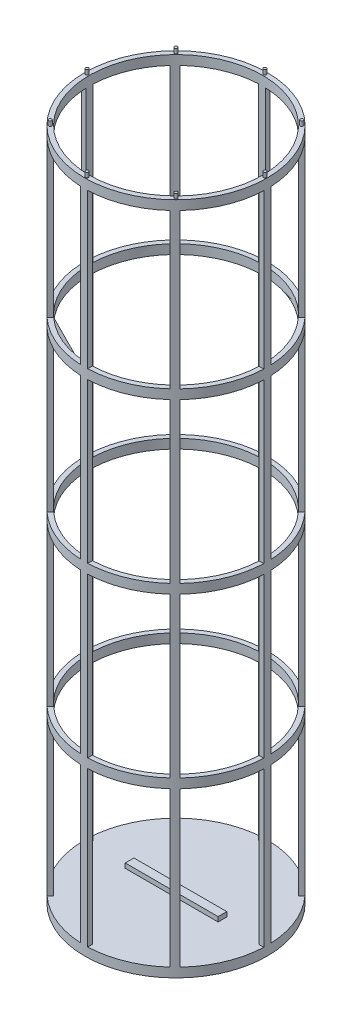
from build123d import *

# Parameters (mm, degrees)
SKETCH1_R           = 49.53
SKETCH1_R_2         = 46.99
BOSS_EXTRUDE1_DEPTH = 182.88
CUT_EXTRUDE1_DEPTH  = 177.8
SKETCH3_R           = 49.53
SKETCH3_R_2         = 46.99
BOSS_EXTRUDE2_DEPTH = 2.54
SKETCH4_R           = 49.53
SKETCH4_R_2         = 46.99
BOSS_EXTRUDE3_DEPTH = 2.54
BOSS_EXTRUDE4_START = -5.08
SKETCH5_R           = 49.53
BOSS_EXTRUDE4_DEPTH = 5.08
SKETCH6_W           = 50.419
SKETCH6_H           = 4.699
BOSS_EXTRUDE5_DEPTH = 2.54
SKETCH7_R           = 0.8255
BOSS_EXTRUDE6_DEPTH = 2.54
CIRPATTERN2_COUNT   = 8


with BuildPart() as part:
    # Sketch1 → Boss-Extrude1 (new, symmetric)
    with BuildSketch(Plane(origin=(0, 0, 0), x_dir=(1, 0, 0), z_dir=(0, 1, 0))):
        with Locations(Location((0, 0, 0), (0, 0, 270))):
            Circle(SKETCH1_R)
        with Locations(Location((0, 0, 0), (0, 0, 270))):
            Circle(SKETCH1_R_2, mode=Mode.SUBTRACT)
    extrude(amount=BOSS_EXTRUDE1_DEPTH, both=True)

    # Sketch2 → Cut-Extrude1 (cut, symmetric)
    with BuildSketch(Plane(origin=(0, 0, 0), x_dir=(1, 0, 0), z_dir=(0, 1, 0))):
        with BuildLine():
            Line((34.339077963, -32.07628134), (36.13611782, -33.873321197))
            ThreePointArc((36.13611782, -33.873321197), (45.710930003, -19.071753413), (49.49527883, -1.854258207))
            Line((49.49527883, -1.854258207), (46.953400585, -1.854258207))
            ThreePointArc((46.953400585, -1.854258207), (43.364264524, -18.099742051), (34.339077963, -32.07628134))
        make_face()
        with BuildLine():
            ThreePointArc((1.584890151, -49.504636381), (18.664975227, -45.878530924), (33.425440685, -36.550797734))
            Line((33.425440685, -36.550797734), (31.627502039, -34.752859088))
            ThreePointArc((31.627502039, -34.752859088), (17.692915235, -43.531837205), (1.584890151, -46.963264614))
            Line((1.584890151, -46.963264614), (1.584890151, -49.504636381))
        make_face()
        with BuildLine():
            ThreePointArc((-33.543952964, -36.442065248), (-19.03558139, -45.726005086), (-2.225109849, -49.479993797))
            Line((-2.225109849, -49.479993797), (-2.225109849, -46.937287801))
            ThreePointArc((-2.225109849, -46.937287801), (-18.063572268, -43.379343666), (-31.746279167, -34.644391451))
            Line((-31.746279167, -34.644391451), (-33.543952964, -36.442065248))
        make_face()
        with BuildLine():
            Line((46.949282998, 1.955741793), (49.491372723, 1.955741793))
            ThreePointArc((49.491372723, 1.955741793), (45.777644234, 18.911059948), (36.442065248, 33.543952964))
            Line((36.442065248, 33.543952964), (34.644391451, 31.746279167))
            ThreePointArc((34.644391451, 31.746279167), (43.430990742, 17.93903964), (46.949282998, 1.955741793))
        make_face()
        with BuildLine():
            ThreePointArc((-49.49527883, -1.854258207), (-45.741824116, -18.997537381), (-36.245883162, -33.755841773))
            Line((-36.245883162, -33.755841773), (-34.448634556, -31.958593167))
            ThreePointArc((-34.448634556, -31.958593167), (-43.39516767, -18.025524205), (-46.953400585, -1.854258207))
            Line((-46.953400585, -1.854258207), (-49.49527883, -1.854258207))
        make_face()
        with BuildLine():
            Line((31.958593167, 34.448634556), (33.755841773, 36.245883162))
            ThreePointArc((33.755841773, 36.245883162), (18.873008967, 45.79334485), (1.584890151, 49.504636381))
            Line((1.584890151, 49.504636381), (1.584890151, 46.963264614))
            ThreePointArc((1.584890151, 46.963264614), (17.900986276, 43.446689061), (31.958593167, 34.448634556))
        make_face()
        with BuildLine():
            ThreePointArc((-36.550797734, 33.425440685), (-45.80828813, 18.836709868), (-49.491372723, 1.955741793))
            Line((-49.491372723, 1.955741793), (-46.949282998, 1.955741793))
            ThreePointArc((-46.949282998, 1.955741793), (-43.461630715, 17.864678995), (-34.752859088, 31.627502039))
            Line((-34.752859088, 31.627502039), (-36.550797734, 33.425440685))
        make_face()
        with BuildLine():
            Line((-2.225109849, 46.937287801), (-2.225109849, 49.479993797))
            ThreePointArc((-2.225109849, 49.479993797), (-19.242893169, 45.63914945), (-33.873321197, 36.13611782))
            Line((-33.873321197, 36.13611782), (-32.07628134, 34.339077963))
            ThreePointArc((-32.07628134, 34.339077963), (-18.270880717, 43.292436035), (-2.225109849, 46.937287801))
        make_face()
    extrude(amount=CUT_EXTRUDE1_DEPTH, both=True, mode=Mode.SUBTRACT)

    # Sketch3 → Boss-Extrude2 (add, symmetric)
    with BuildSketch(Plane(origin=(0, 91.44, 0), x_dir=(1, 0, 0), z_dir=(0, 1, 0))):
        with Locations(Location((0, 0, 0), (0, 0, 270))):
            Circle(SKETCH3_R)
        with Locations(Location((0, 0, 0), (0, 0, 270))):
            Circle(SKETCH3_R_2, mode=Mode.SUBTRACT)
    boss_extrude2 = extrude(amount=BOSS_EXTRUDE2_DEPTH, both=True)

    # Mirror1: Boss-Extrude2 across plane
    add(boss_extrude2.mirror(Plane.ZX))

    # Sketch4 → Boss-Extrude3 (add, symmetric)
    with BuildSketch(Plane(origin=(0, 0, 0), x_dir=(1, 0, 0), z_dir=(0, 1, 0))):
        with Locations(Location((0, 0, 0), (0, 0, 270))):
            Circle(SKETCH4_R)
        with Locations(Location((0, 0, 0), (0, 0, 270))):
            Circle(SKETCH4_R_2, mode=Mode.SUBTRACT)
    extrude(amount=BOSS_EXTRUDE3_DEPTH, both=True)

    # Sketch5 → Boss-Extrude4 (add)
    with BuildSketch(Plane.XZ.offset(182.88).offset(BOSS_EXTRUDE4_START)):
        with Locations(Location((0, 0, 0), (0, 0, 90))):
            Circle(SKETCH5_R)
    extrude(amount=BOSS_EXTRUDE4_DEPTH)

    # Sketch6 → Boss-Extrude5 (add)
    with BuildSketch(Plane(origin=(0, -177.8, 0), x_dir=(1, 0, 0), z_dir=(0, 1, 0))):
        Rectangle(SKETCH6_W, SKETCH6_H)
    extrude(amount=BOSS_EXTRUDE5_DEPTH)

    # Sketch7 → Boss-Extrude6 (add)
    with BuildSketch(Plane(origin=(0, 182.88, 0), x_dir=(1, 0, 0), z_dir=(0, 1, 0))):
        with Locations(Location((48.26, 0, 0), (0, 0, 270))):
            Circle(SKETCH7_R)
    boss_extrude6 = extrude(amount=BOSS_EXTRUDE6_DEPTH)

    # CirPattern2: Boss-Extrude6 ×8 about axis
    cirpattern2_axis = Axis((0, 0, 0), (0, 1, 0))
    for i in range(1, CIRPATTERN2_COUNT):
        add(boss_extrude6.rotate(cirpattern2_axis, i * 360 / CIRPATTERN2_COUNT))


solid = part.part
